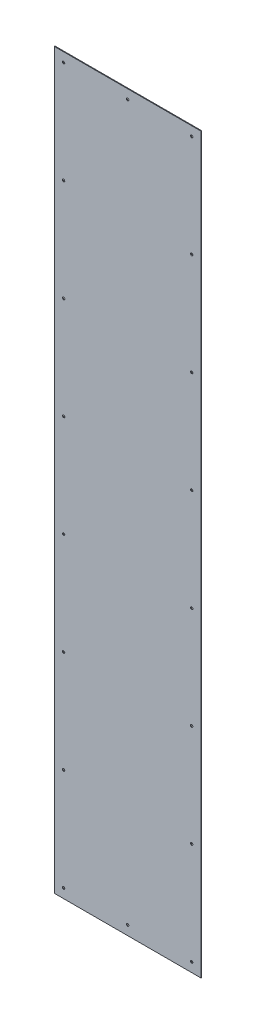
from build123d import *

# Parameters (mm, degrees)
CROQUIS1_W              = 400
CROQUIS1_H              = 2000
SALIENTE_EXTRUIR1_DEPTH = 1.9
CROQUIS2_R              = 3.175
CORTAR_EXTRUIR2_DEPTH   = 10


with BuildPart() as part:
    # Croquis1 → Saliente-Extruir1 (new body)
    with BuildSketch(Plane.XY):
        Rectangle(CROQUIS1_W, CROQUIS1_H)
    extrude(amount=SALIENTE_EXTRUIR1_DEPTH)

    # Croquis2 → Cortar-Extruir2 (cut)
    with BuildSketch(Plane.XY.offset(1.9)):
        with Locations((-174.6, 974.6)):
            Circle(CROQUIS2_R)
        with Locations((0, 974.6)):
            Circle(CROQUIS2_R)
        with Locations((174.6, 974.6)):
            Circle(CROQUIS2_R)
        with Locations((-174.6, 696.15)):
            Circle(CROQUIS2_R)
        with Locations((-174.6, 417.7)):
            Circle(CROQUIS2_R)
        with Locations((-174.6, 139.25)):
            Circle(CROQUIS2_R)
        with Locations((-174.6, -139.2)):
            Circle(CROQUIS2_R)
        with Locations((-174.6, -417.65)):
            Circle(CROQUIS2_R)
        with Locations((-174.6, -696.1)):
            Circle(CROQUIS2_R)
        with Locations((-174.6, -974.6)):
            Circle(CROQUIS2_R)
        with Locations((0, -974.6)):
            Circle(CROQUIS2_R)
        with Locations((174.6, -974.6)):
            Circle(CROQUIS2_R)
        with Locations((174.6, -696.1)):
            Circle(CROQUIS2_R)
        with Locations((174.6, -417.65)):
            Circle(CROQUIS2_R)
        with Locations((174.6, -139.2)):
            Circle(CROQUIS2_R)
        with Locations((174.6, 139.25)):
            Circle(CROQUIS2_R)
        with Locations((174.6, 417.7)):
            Circle(CROQUIS2_R)
        with Locations((174.6, 696.15)):
            Circle(CROQUIS2_R)
    extrude(amount=-CORTAR_EXTRUIR2_DEPTH, mode=Mode.SUBTRACT)


solid = part.part
